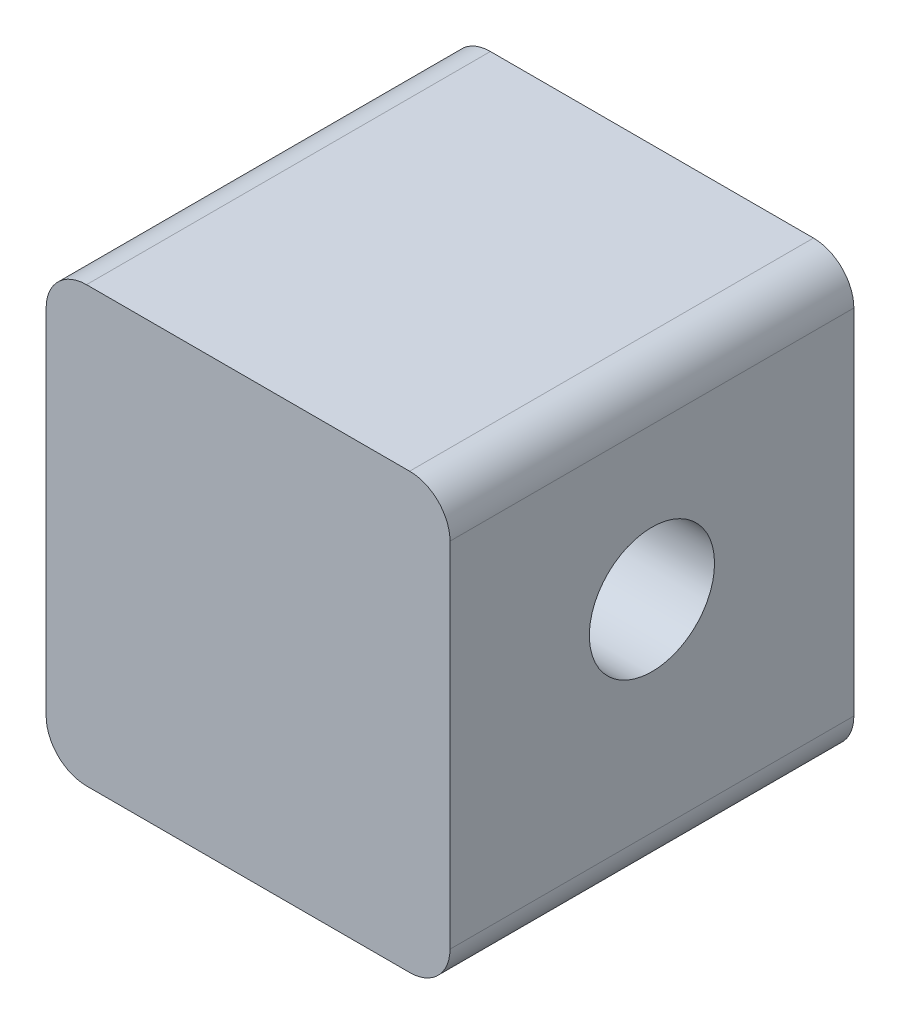
from build123d import *

# Parameters (mm, degrees)
BOSS_EXTRUDE1_DEPTH     = 10
CUT_EXTRUDE1_DEPTH      = 26.734218465
CUT_EXTRUDE1_DEPTH_BACK = 26.734218465
SKETCH2_R               = 3.1
SKETCH3_R               = 2
CUT_EXTRUDE2_DEPTH      = 8.5


with BuildPart() as part:
    # Sketch1 → Boss-Extrude1 (new, symmetric)
    with BuildSketch(Plane.XY):
        with BuildLine():
            Line((-8, -21.5), (8, -21.5))
            ThreePointArc((8, -21.5), (9.414213562, -20.914213562), (10, -19.5))
            Line((10, -19.5), (10, -2))
            ThreePointArc((10, -2), (9.414213562, -0.585786438), (8, 0))
            Line((8, 0), (-8, 0))
            ThreePointArc((-8, 0), (-9.414213562, -0.585786438), (-10, -2))
            Line((-10, -2), (-10, -19.5))
            ThreePointArc((-10, -19.5), (-9.414213562, -20.914213562), (-8, -21.5))
        make_face()
    extrude(amount=BOSS_EXTRUDE1_DEPTH, both=True)

    # Sketch2 → Cut-Extrude1 (cut, two sides: drawn at the far end of the back side and taken through both)
    with BuildSketch(Plane(origin=(0, 0, 0), x_dir=(0, 0, -1), z_dir=(1, 0, 0)).offset(-CUT_EXTRUDE1_DEPTH_BACK)):
        with Locations((0, -9.5)):
            Circle(SKETCH2_R)
    extrude(amount=CUT_EXTRUDE1_DEPTH + CUT_EXTRUDE1_DEPTH_BACK, mode=Mode.SUBTRACT)

    # Sketch3 → Cut-Extrude2 (cut)
    with BuildSketch(Plane(origin=(0, -21.5, 0), x_dir=(1, 0, 0), z_dir=(0, 1, 0))):
        with Locations(Location((0, 0, 0), (0, 0, 270))):
            Circle(SKETCH3_R)
    extrude(amount=CUT_EXTRUDE2_DEPTH, mode=Mode.SUBTRACT)


solid = part.part
